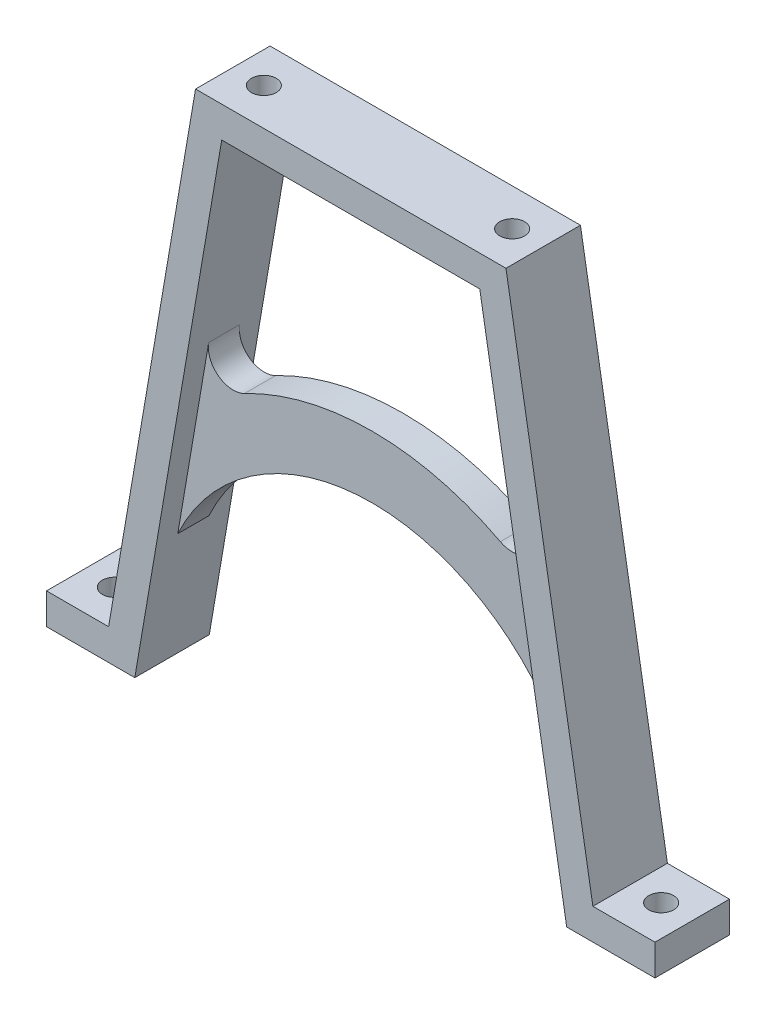
from build123d import *

# Parameters (mm, degrees)
BOSS_EXTRUDE1_DEPTH = 6
BOSS_EXTRUDE2_DEPTH = 2.5
FILLET1_R           = 4
SKETCH3_R           = 2
CUT_EXTRUDE1_DEPTH  = 96.713112999
SKETCH4_R           = 2
CUT_EXTRUDE2_DEPTH  = 5


with BuildPart() as part:
    # Sketch1 → Boss-Extrude1 (new, symmetric)
    with BuildSketch(Plane.XY):
        Polygon((-49, 0), (-34.781308697, 0), (-20.781308697, 82), (20.781308697, 82), (34.781308697, 0), (49, 0), (49, 5), (39, 5), (25, 87), (-25, 87), (-39, 5), (-49, 5), align=None)
    extrude(amount=BOSS_EXTRUDE1_DEPTH, both=True)

    # Sketch2 → Boss-Extrude2 (add, symmetric)
    with BuildSketch(Plane.XY):
        with BuildLine():
            Line((31.450240635, 19.510541506), (27.939451789, 40.073733316))
            ThreePointArc((27.939451789, 40.073733316), (0.037609002, 49.999938394), (-27.914924838, 40.217391174))
            Line((-27.914924838, 40.217391174), (-31.357853442, 20.051666495))
            ThreePointArc((-31.357853442, 20.051666495), (0.220379798, 39.998805231), (31.450240635, 19.510541506))
        make_face()
    extrude(amount=BOSS_EXTRUDE2_DEPTH, both=True)

    # Fillet1
    fillet1_edges = [part.edges().sort_by_distance(p)[0] for p in [
        (27.939451789, 40.073733316, 0),
        (-27.914924838, 40.217391174, 0),
    ]]
    fillet(fillet1_edges, radius=FILLET1_R)

    # Sketch3 → Cut-Extrude1 (cut, through all)
    with BuildSketch(Plane(origin=(0, 5, 0), x_dir=(1, 0, 0), z_dir=(0, 1, 0))):
        with Locations(Location((-44, 0, 0), (0, 0, 180))):
            Circle(SKETCH3_R)
        with Locations(Location((44, 0, 0), (0, 0, 180))):
            Circle(SKETCH3_R)
    extrude(amount=-CUT_EXTRUDE1_DEPTH, mode=Mode.SUBTRACT)

    # Sketch4 → Cut-Extrude2 (cut)
    with BuildSketch(Plane(origin=(0, 87, 0), x_dir=(1, 0, 0), z_dir=(0, 1, 0))):
        with Locations(Location((-20, 0, 0), (0, 0, 270))):
            Circle(SKETCH4_R)
        with Locations(Location((20, 0, 0), (0, 0, 270))):
            Circle(SKETCH4_R)
    extrude(amount=-CUT_EXTRUDE2_DEPTH, mode=Mode.SUBTRACT)


solid = part.part
